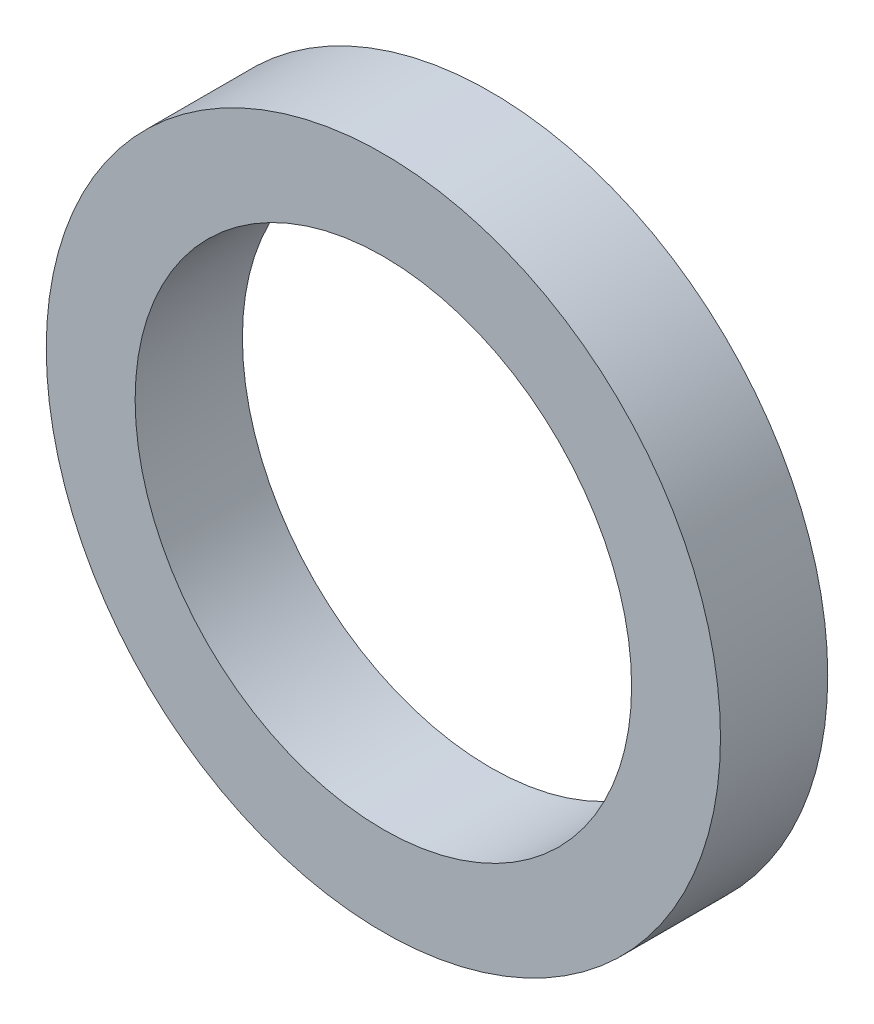
from build123d import *

# Parameters (mm, degrees)
SKETCH1_W = 2.9
SKETCH1_H = 3.5


with BuildPart() as part:
    # Sketch1 → Revolve1 (revolve)
    with BuildSketch(Plane.XZ, mode=Mode.PRIVATE) as revolve1_sk:
        with Locations((9.55, 1.75)):
            Rectangle(SKETCH1_W, SKETCH1_H)
    revolve(revolve1_sk.sketch.rotate(Axis((0, 0, 3.5), (0, 0, -1)), 180), axis=Axis((0, 0, 3.5), (0, 0, -1)))


solid = part.part
